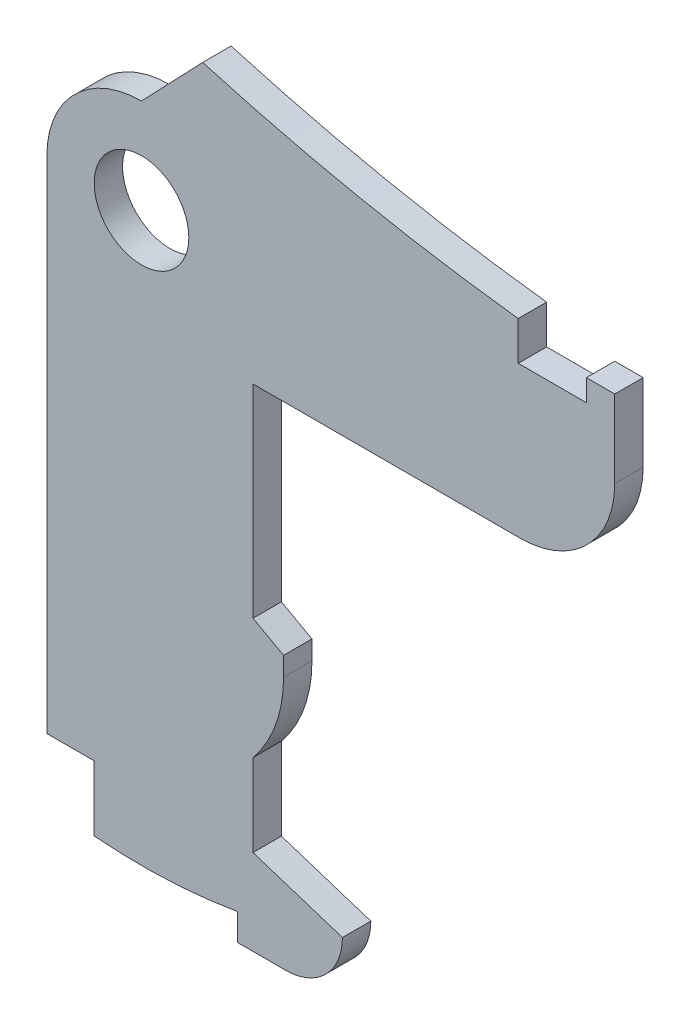
from build123d import *

# Parameters (mm, degrees)
SKETCH_1_R      = 2.5
EXTRUDE_1_DEPTH = 1.5


with BuildPart() as part:
    # 스케치1 → 보스-돌출1 (new body)
    with BuildSketch(Plane.XY):
        with BuildLine():
            Line((58.562856649, -69.110949309), (61.100431709, -69.110949309))
            ThreePointArc((61.100431709, -69.110949309), (63.221752053, -68.232269653), (64.100431709, -66.110949309))
            Line((64.100431709, -66.110949309), (59.376120264, -64.586771365))
            Line((59.376120264, -64.586771365), (59.376120264, -60.240028533))
            ThreePointArc((59.376120264, -60.240028533), (60.576391584, -58.13775418), (60.992924776, -55.753072063))
            Line((60.992924776, -55.753072063), (60.992924776, -54.755314285))
            Line((60.992924776, -54.755314285), (59.376120264, -53.867981647))
            Line((59.376120264, -53.867981647), (59.376120264, -43.149191929))
            Line((59.376120264, -43.149191929), (73.486715323, -43.149191929))
            ThreePointArc((73.486715323, -43.149191929), (77.022249229, -41.684725835), (78.486715323, -38.149191929))
            Line((78.486715323, -38.149191929), (78.486715323, -34.05327534))
            Line((78.486715323, -34.05327534), (76.986715323, -34.05327534))
            Line((76.986715323, -34.05327534), (76.986715323, -35.198463464))
            Line((76.986715323, -35.198463464), (73.386715323, -35.198463464))
            Line((73.386715323, -35.198463464), (73.386715323, -33.149191929))
            ThreePointArc((73.386715323, -33.149191929), (64.982885636, -31.8013595), (56.718627509, -29.765912799))
            Line((56.718627509, -29.765912799), (53.486715323, -33.149191929))
            ThreePointArc((53.486715323, -33.149191929), (49.951181417, -34.613658023), (48.486715323, -38.149191929))
            Line((48.486715323, -38.149191929), (48.486715323, -64.586869755))
            Line((48.486715323, -64.586869755), (50.986715323, -64.586869755))
            Line((50.986715323, -64.586869755), (50.986715323, -68.023666262))
            ThreePointArc((50.986715323, -68.023666262), (54.785213458, -68.09995351), (58.562856649, -67.695206989))
            Line((58.562856649, -67.695206989), (58.562856649, -69.110949309))
        make_face()
        with Locations((53.486715323, -38.149191929)):
            Circle(SKETCH_1_R, mode=Mode.SUBTRACT)
    extrude(amount=EXTRUDE_1_DEPTH)


solid = part.part
